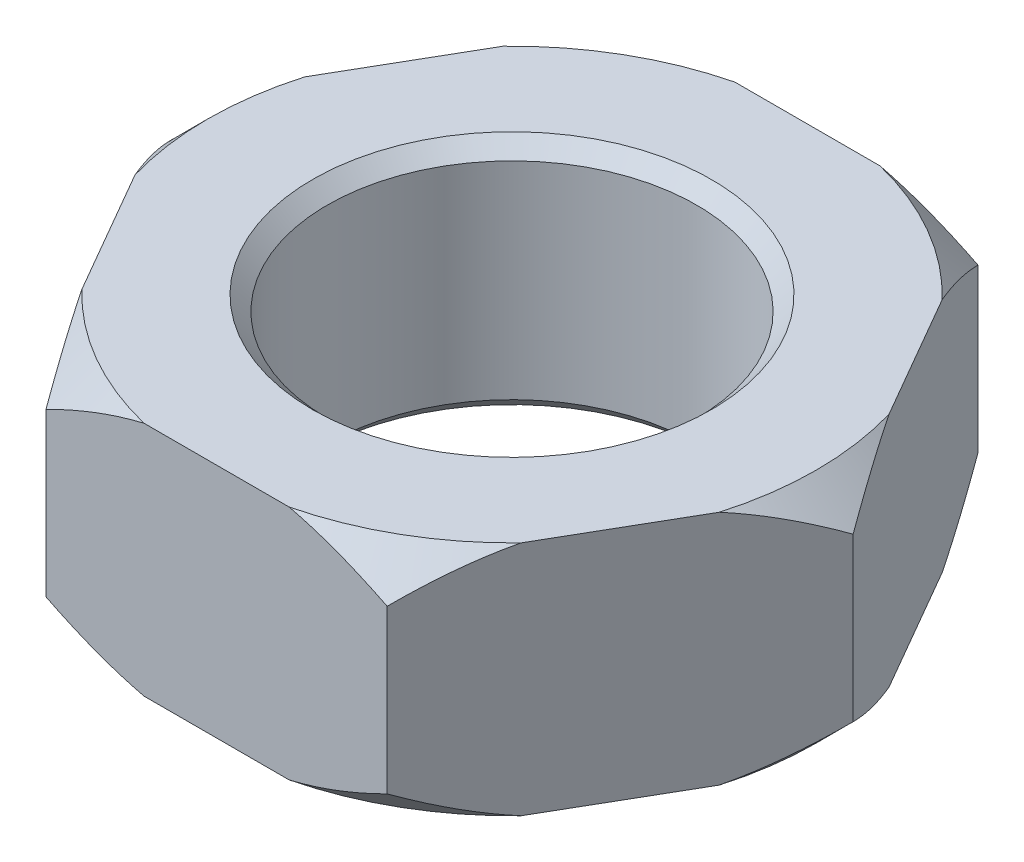
from build123d import *

# Parameters (mm, degrees)
EXTRUDE_1_DEPTH     = 3.2
SKETCH_5_R          = 2.5
CUT_EXTRUDE_1_DEPTH = 7.897342483
CHAMFER_1_SIZE      = 0.2


with BuildPart() as part:
    # Эскиз1 → Вытянуть1 (new body)
    with BuildSketch(Plane(origin=(0, 0, 0), x_dir=(1, 0, 0), z_dir=(0, 1, 0))):
        Polygon((-2.309401077, 4), (2.309401077, 4), (4.618802154, 0), (2.309401077, -4), (-2.309401077, -4), (-4.618802154, 0), align=None)
    extrude(amount=-EXTRUDE_1_DEPTH)

    # Эскиз5 → Вырез-Вытянуть1 (cut, through all)
    with BuildSketch(Plane.XZ.offset(3.2)):
        with Locations(Location((0, 0, 0), (0, 0, 270))):
            Circle(SKETCH_5_R)
    extrude(amount=-CUT_EXTRUDE_1_DEPTH, mode=Mode.SUBTRACT)

    # Эскиз4 → Вырез-Повернуть1 (revolve, cut)
    with BuildSketch(Plane.XY):
        Polygon((-4.618802154, -0.5), (-4.118802154, 0), (-4.618802154, 0), align=None)
        Polygon((-4.618802154, -2.7), (-4.118802154, -3.2), (-4.618802154, -3.2), align=None)
    revolve(axis=Axis((0, 0, 0), (0, -1, 0)), mode=Mode.SUBTRACT)

    # Фаска1
    chamfer_1_edges = [part.edges().sort_by_distance(p)[0] for p in [
        (0, 0, 2.5),
        (0, -3.2, 2.5),
    ]]
    chamfer(chamfer_1_edges, length=CHAMFER_1_SIZE)


solid = part.part
